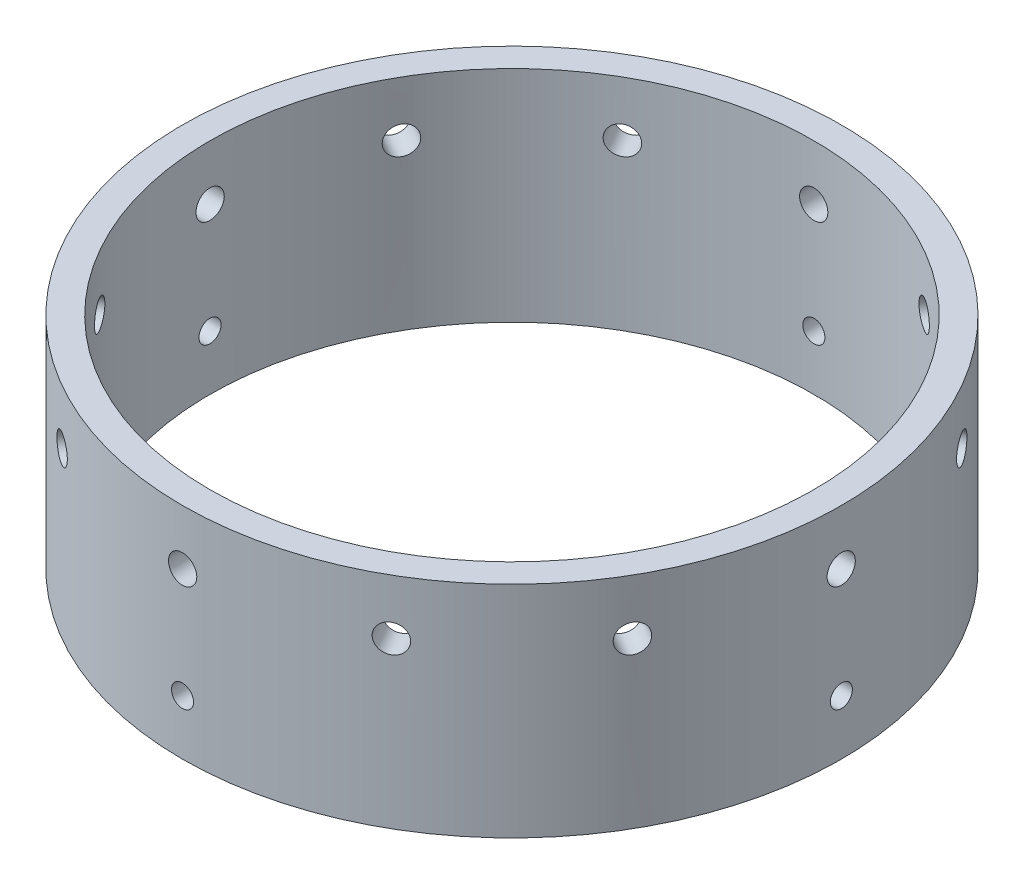
from build123d import *

# Parameters (mm, degrees)
SKETCH2_R                    = 76.2
SKETCH2_R_2                  = 69.85
BOSS_EXTRUDE1_DEPTH          = 50.8
SKETCH3_R                    = 3.2639
CUT_EXTRUDE1_DEPTH           = 120.1365603
CIRPATTERN1_COUNT            = 12
F_1_4_20_TAPPED_HOLE2_REACH  = 179.8
F_1_4_20_TAPPED_HOLE2_BORE_R = 2.5527
CIRPATTERN3_COUNT            = 4


with BuildPart() as part:
    # Sketch2 → Boss-Extrude1 (new body)
    with BuildSketch(Plane(origin=(0, 0, 0), x_dir=(1, 0, 0), z_dir=(0, 1, 0))):
        with Locations(Location((0, 0, 0), (0, 0, 270))):
            Circle(SKETCH2_R)
        with Locations(Location((0, 0, 0), (0, 0, 270))):
            Circle(SKETCH2_R_2, mode=Mode.SUBTRACT)
    extrude(amount=BOSS_EXTRUDE1_DEPTH)

    # Sketch3 → Cut-Extrude1 (cut, through all)
    with BuildSketch(Plane.XY):
        with Locations(Location((0, 38.1, 0), (0, 0, 90))):
            Circle(SKETCH3_R)
    cut_extrude1 = extrude(amount=-CUT_EXTRUDE1_DEPTH, mode=Mode.SUBTRACT)

    # CirPattern1: Cut-Extrude1 ×12 about axis
    cirpattern1_axis = Axis((0, 50.8, 0), (0, 1, 0))
    for i in range(1, CIRPATTERN1_COUNT):
        add(cut_extrude1.rotate(cirpattern1_axis, i * 360 / CIRPATTERN1_COUNT), mode=Mode.SUBTRACT)

    # 1/4-20 Tapped Hole2 bore → 1/4-20 Tapped Hole2 (cut, up to next)
    with BuildSketch(Plane.XY.offset(76.2), mode=Mode.PRIVATE) as f_1_4_20_tapped_hole2_sk1:
        with Locations((0, 12.7)):
            Circle(F_1_4_20_TAPPED_HOLE2_BORE_R)
    f_1_4_20_tapped_hole2_tool1 = extrude(f_1_4_20_tapped_hole2_sk1.sketch, amount=-F_1_4_20_TAPPED_HOLE2_REACH, mode=Mode.PRIVATE) & part.part
    f_1_4_20_tapped_hole2 = f_1_4_20_tapped_hole2_tool1.solids().sort_by_distance((0, 12.7, 76.2))[0]
    add(f_1_4_20_tapped_hole2, mode=Mode.SUBTRACT)

    # CirPattern3: 1/4-20 Tapped Hole2 ×4 about axis
    cirpattern3_axis = Axis((0, 50.8, 0), (0, 1, 0))
    for i in range(1, CIRPATTERN3_COUNT):
        add(f_1_4_20_tapped_hole2.rotate(cirpattern3_axis, i * 360 / CIRPATTERN3_COUNT), mode=Mode.SUBTRACT)


solid = part.part
